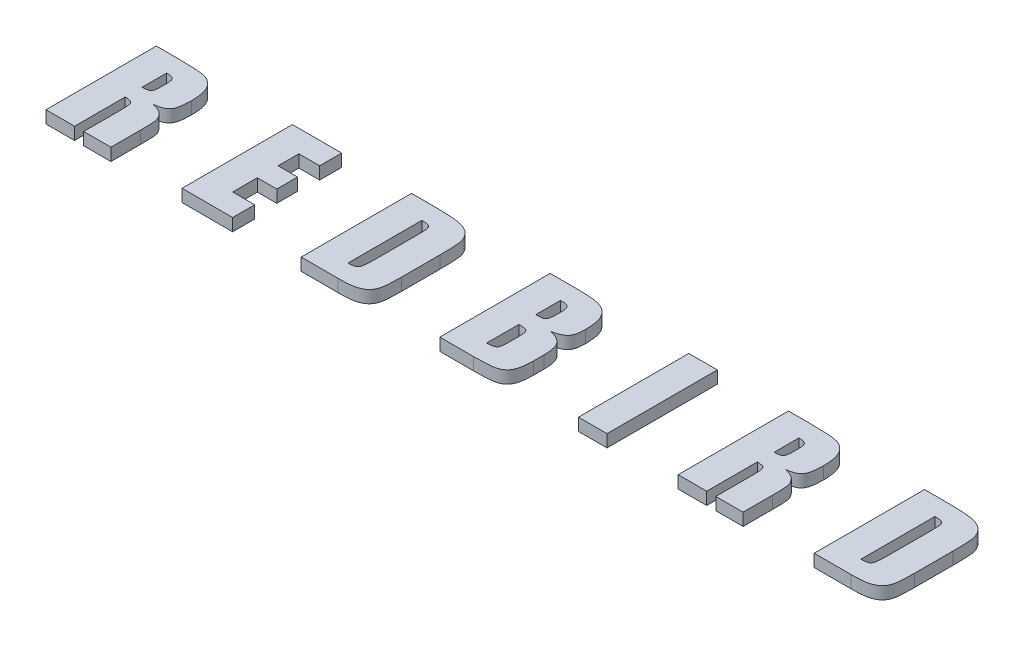
from build123d import *

# Parameters (mm, degrees)
BOSS_EXTRUDE1_DEPTH   = 2
BOSS_EXTRUDE1_2_DEPTH = 2
BOSS_EXTRUDE1_3_DEPTH = 2
BOSS_EXTRUDE1_4_DEPTH = 2
SKETCH1_W             = 4.607058824
SKETCH1_H             = 17.8
BOSS_EXTRUDE1_5_DEPTH = 2
BOSS_EXTRUDE1_6_DEPTH = 2
BOSS_EXTRUDE1_7_DEPTH = 2


with BuildPart() as part:
    # Sketch1 → Boss-Extrude1 (new body)
    with BuildSketch(Plane(origin=(0, 0, 0), x_dir=(1, 0, 0), z_dir=(0, 1, 0))):
        with BuildLine():
            Line((-82.469050164, 17.8), (-79.151182517, 17.8))
            add(Edge.make_bspline(
                [(-79.151182517, 17.8), (-78.885048071, 17.799746774), (-78.37564711, 17.79926208), (-77.645936562, 17.78538026), (-76.983846399, 17.766002963), (-76.388090793, 17.741565138), (-75.859027453, 17.705452776), (-75.397437707, 17.663742527), (-75.002990983, 17.616494116), (-74.665900726, 17.557852604), (-74.368796495, 17.481561226), (-74.09458711, 17.381352943), (-73.832210295, 17.262100109), (-73.584721874, 17.113096617), (-73.35386095, 16.938161971), (-73.131375941, 16.74588602), (-72.928888586, 16.522491955), (-72.73405574, 16.278492607), (-72.557936751, 16.000139591), (-72.408995424, 15.684134256), (-72.281156478, 15.331396038), (-72.177457893, 14.940358153), (-72.097142861, 14.51155242), (-72.037781889, 14.045112188), (-72.007210989, 13.540187643), (-72.001448573, 13.190795077), (-71.998461929, 13.009705882)],
                knots=[0, 0, 0, 0, 1.866779899, 3.573154429, 5.119271976, 6.513038993, 7.755301935, 8.838622109, 9.763847579, 10.541210176, 11.237085048, 11.91229758, 12.586642675, 13.255803272, 13.93365463, 14.616667368, 15.3150611, 16.045129356, 16.805014908, 17.619443337, 18.490747182, 19.433519973, 20.453845581, 21.548934602, 22.729619622, 24, 24, 24, 24], degree=3))
            add(Edge.make_bspline(
                [(-71.998461929, 13.009705882), (-71.998869517, 12.846042972), (-71.99964997, 12.532659944), (-72.028811716, 12.083224302), (-72.0634222, 11.675172901), (-72.124520729, 11.309740541), (-72.193829031, 10.985329626), (-72.280999434, 10.700488785), (-72.387608539, 10.458773482), (-72.511432704, 10.253578282), (-72.661484897, 10.080963205), (-72.839729815, 9.929217942), (-73.052023992, 9.799607152), (-73.29319038, 9.68449234), (-73.564983969, 9.586848051), (-73.868786276, 9.509887602), (-74.20301941, 9.446466222), (-74.438073064, 9.422777669), (-74.560483988, 9.410441176)],
                knots=[0, 0, 0, 0, 1.535739318, 2.940645737, 4.22619795, 5.377388088, 6.415609046, 7.338391501, 8.167869762, 8.889512328, 9.579072284, 10.305275152, 11.07790705, 11.906690103, 12.810190808, 13.783547141, 14.845718681, 16, 16, 16, 16], degree=3))
            add(Edge.make_bspline(
                [(-74.560483988, 9.410441176), (-74.450160573, 9.380493895), (-74.237295397, 9.322711661), (-73.932459733, 9.229695807), (-73.656494643, 9.125762822), (-73.411918643, 9.010299375), (-73.192401918, 8.893331362), (-73.002780633, 8.766179313), (-72.840047843, 8.631554403), (-72.666600073, 8.44707956), (-72.492335549, 8.214819331), (-72.31861125, 7.9434932), (-72.19303994, 7.681005162), (-72.119319313, 7.458291592), (-72.086834132, 7.256791003), (-72.059332836, 7.056358761), (-72.042721933, 6.801649037), (-72.025999062, 6.494091862), (-72.013809709, 6.134078726), (-72.002972558, 5.721803901), (-72.002088123, 5.256010182), (-71.999715329, 4.927717909), (-71.998461929, 4.754301471)],
                knots=[0, 0, 0, 0, 1.142598363, 2.204603636, 3.184543099, 4.08681795, 4.906404162, 5.66835307, 6.364867417, 7.012577891, 8.194392783, 9.262145755, 10.227668168, 11.096526183, 11.594793942, 12.265491166, 13.118334537, 14.144541448, 15.344519214, 16.718520618, 18.266598052, 20, 20, 20, 20], degree=3))
            Line((-71.998461929, 4.754301471), (-71.998461929, 0))
            Line((-71.998461929, 0), (-76.396108988, 0))
            Line((-76.396108988, 0), (-76.396108988, 6.020588235))
            add(Edge.make_bspline(
                [(-76.396108988, 6.020588235), (-76.396783572, 6.136201112), (-76.39806301, 6.355476342), (-76.406249688, 6.666596639), (-76.426883667, 6.943659859), (-76.451190776, 7.186237495), (-76.484322609, 7.394761595), (-76.520619455, 7.568797628), (-76.569786112, 7.708249074), (-76.626025661, 7.819041817), (-76.699298274, 7.908496927), (-76.798977456, 7.975284088), (-76.916242846, 8.038667249), (-77.06001769, 8.087120212), (-77.227208604, 8.121104974), (-77.417438538, 8.146910743), (-77.631585306, 8.163119692), (-77.782340661, 8.165697078), (-77.861991341, 8.167058824)],
                knots=[0, 0, 0, 0, 1.760695112, 3.339392938, 4.738153348, 5.990939473, 7.050443991, 7.953034352, 8.693792368, 9.295646617, 9.837944077, 10.432650982, 11.108765438, 11.865186032, 12.731754792, 13.704231872, 14.787044802, 16, 16, 16, 16], degree=3))
            Line((-77.861991341, 8.167058824), (-77.861991341, 0))
            Line((-77.861991341, 0), (-82.469050164, 0))
            Line((-82.469050164, 0), (-82.469050164, 17.8))
        make_face()
        with BuildLine():
            Line((-77.861991341, 14.868235294), (-77.861991341, 10.889411765))
            add(Edge.make_bspline(
                [(-77.861991341, 10.889411765), (-77.736431229, 10.891103762), (-77.504081576, 10.894234811), (-77.186775362, 10.936223191), (-76.929311716, 10.998988843), (-76.749299256, 11.076627881), (-76.64096283, 11.175825675), (-76.571312497, 11.276521012), (-76.518574108, 11.410155102), (-76.473134831, 11.571374015), (-76.43851351, 11.762055014), (-76.411913041, 11.981596165), (-76.401285797, 12.231954117), (-76.397903559, 12.40873769), (-76.396108988, 12.502536765)],
                knots=[0, 0, 0, 0, 1.706714887, 3.158284942, 4.338247242, 5.313333341, 5.775274278, 6.318418262, 6.963057242, 7.71890888, 8.594501264, 9.595306132, 10.724100569, 12, 12, 12, 12], degree=3))
            Line((-76.396108988, 12.502536765), (-76.396108988, 13.487426471))
            add(Edge.make_bspline(
                [(-76.396108988, 13.487426471), (-76.399040934, 13.617487449), (-76.404376312, 13.854164558), (-76.460776381, 14.174342074), (-76.554858584, 14.425980847), (-76.701226961, 14.615602183), (-76.911993474, 14.731507463), (-77.171143004, 14.815452592), (-77.496251155, 14.860484524), (-77.733183614, 14.865505599), (-77.861991341, 14.868235294)],
                knots=[0, 0, 0, 0, 1.304469539, 2.37379483, 3.247992823, 3.979792534, 4.721435155, 5.621572954, 6.706974207, 8, 8, 8, 8], degree=3))
        make_face(mode=Mode.SUBTRACT)
    extrude(amount=BOSS_EXTRUDE1_DEPTH)


with BuildPart() as body_2:
    # Sketch1 → Boss-Extrude1 2 (new body)
    with BuildSketch(Plane(origin=(0, 0, 0), x_dir=(1, 0, 0), z_dir=(0, 1, 0))):
        Polygon((-60.522697223, 17.8), (-52.565050164, 17.8), (-52.565050164, 14.24), (-55.915638399, 14.24), (-55.915638399, 10.889411765), (-52.774461929, 10.889411765), (-52.774461929, 7.538823529), (-55.915638399, 7.538823529), (-55.915638399, 3.56), (-52.355638399, 3.56), (-52.355638399, 0), (-60.522697223, 0), align=None)
    extrude(amount=BOSS_EXTRUDE1_2_DEPTH)


with BuildPart() as body_3:
    # Sketch1 → Boss-Extrude1 3 (new body)
    with BuildSketch(Plane(origin=(0, 0, 0), x_dir=(1, 0, 0), z_dir=(0, 1, 0))):
        with BuildLine():
            Line((-41.298697223, 17.8), (-37.781233988, 17.8))
            add(Edge.make_bspline(
                [(-37.781233988, 17.8), (-37.508549339, 17.800102765), (-36.987118488, 17.800299273), (-36.238893338, 17.781790192), (-35.559266919, 17.760347417), (-34.948061583, 17.729955743), (-34.407151589, 17.682762032), (-33.934349003, 17.632224875), (-33.529879848, 17.572429063), (-33.090804099, 17.478858112), (-32.620956789, 17.329011045), (-32.121340123, 17.104040025), (-31.69315818, 16.826517371), (-31.343233635, 16.492717791), (-31.059556187, 16.12966347), (-30.832828497, 15.744395814), (-30.664420262, 15.33950577), (-30.5718119, 14.977630999), (-30.527083061, 14.655007758), (-30.493682387, 14.360541214), (-30.469945181, 14.014388557), (-30.445584701, 13.616371964), (-30.431502301, 13.166812212), (-30.416996352, 12.664043156), (-30.412028362, 12.109896952), (-30.410225141, 11.722695093), (-30.409285458, 11.520919118)],
                knots=[0, 0, 0, 0, 1.647732484, 3.150813787, 4.522492356, 5.756747403, 6.848149703, 7.803076608, 8.6298837, 9.317612603, 10.514070139, 11.602283645, 12.620483519, 13.580944175, 14.510468184, 15.396689994, 16.274291962, 17.15189393, 17.644977889, 18.241807204, 18.942427062, 19.741256606, 20.651394465, 21.66014324, 22.780669903, 24, 24, 24, 24], degree=3))
            Line((-30.409285458, 11.520919118), (-30.409285458, 5.287647059))
            add(Edge.make_bspline(
                [(-30.409285458, 5.287647059), (-30.410008402, 5.09677847), (-30.411396557, 4.730283164), (-30.419208468, 4.205482947), (-30.441269173, 3.730071581), (-30.460931467, 3.304277182), (-30.494507294, 2.929053845), (-30.531588676, 2.60221616), (-30.580758608, 2.326242954), (-30.64793831, 2.02697032), (-30.7597953, 1.704407019), (-30.942337654, 1.36405146), (-31.162901496, 1.062933513), (-31.431165683, 0.810322495), (-31.737229902, 0.600632485), (-32.074139183, 0.422368125), (-32.445247736, 0.2786765), (-32.781047606, 0.190090867), (-33.073999282, 0.134014704), (-33.324311921, 0.099636441), (-33.599983377, 0.065289151), (-33.903725382, 0.044746326), (-34.232020587, 0.025329432), (-34.587515855, 0.006989652), (-34.969440586, 0.002998232), (-35.233394383, 0.001021159), (-35.369726635, 0)],
                knots=[0, 0, 0, 0, 1.555791815, 2.987345376, 4.277512103, 5.434898526, 6.461117292, 7.347678525, 8.115012592, 8.744704908, 9.846861435, 10.884910755, 11.882385618, 12.875930665, 13.872255975, 14.898282186, 15.976332072, 17.108484732, 17.723959223, 18.406646654, 19.167516123, 19.987768807, 20.887251258, 21.848409784, 22.888702715, 24, 24, 24, 24], degree=3))
            Line((-35.369726635, 0), (-41.298697223, 0))
            Line((-41.298697223, 0), (-41.298697223, 17.8))
        make_face()
        with BuildLine():
            Line((-36.691638399, 14.868235294), (-36.691638399, 2.931764706))
            add(Edge.make_bspline(
                [(-36.691638399, 2.931764706), (-36.601084462, 2.932934173), (-36.428467074, 2.935163456), (-36.182383624, 2.954099608), (-35.964194138, 2.987488448), (-35.771737032, 3.02604445), (-35.609967674, 3.088190316), (-35.469550131, 3.15301294), (-35.360254371, 3.23937606), (-35.273711745, 3.342126343), (-35.21107877, 3.475039749), (-35.160746002, 3.645130255), (-35.116203298, 3.858685916), (-35.077816097, 4.115353039), (-35.048822893, 4.415690404), (-35.031123613, 4.759588297), (-35.016941394, 5.147923413), (-35.016550041, 5.421785541), (-35.016344282, 5.565772059)],
                knots=[0, 0, 0, 0, 1.15083661, 2.193768883, 3.132775297, 3.956688284, 4.680278661, 5.331177994, 5.91352505, 6.435313492, 7.024222413, 7.765131037, 8.686789015, 9.794406953, 11.061955528, 12.519784999, 14.170232443, 16, 16, 16, 16], degree=3))
            Line((-35.016344282, 5.565772059), (-35.016344282, 12.617058824))
            add(Edge.make_bspline(
                [(-35.016344282, 12.617058824), (-35.01565768, 12.715228837), (-35.014352948, 12.901778791), (-35.023105181, 13.167857897), (-35.028374013, 13.406776059), (-35.037406103, 13.61850345), (-35.052117089, 13.801521517), (-35.061950901, 13.957105844), (-35.083637447, 14.084252606), (-35.106270567, 14.217962971), (-35.157821815, 14.356986961), (-35.242305594, 14.502315777), (-35.361883573, 14.619475724), (-35.514627316, 14.716308888), (-35.717442516, 14.787409643), (-35.981552385, 14.837702327), (-36.31376533, 14.863334291), (-36.558540458, 14.866509018), (-36.691638399, 14.868235294)],
                knots=[0, 0, 0, 0, 1.362971426, 2.590019582, 3.69595568, 4.681371814, 5.531603618, 6.245950658, 6.84352033, 7.321700785, 8.126479698, 8.887462659, 9.6370587, 10.426879731, 11.380478843, 12.6011556, 14.151858001, 16, 16, 16, 16], degree=3))
        make_face(mode=Mode.SUBTRACT)
    extrude(amount=BOSS_EXTRUDE1_3_DEPTH)


with BuildPart() as body_4:
    # Sketch1 → Boss-Extrude1 4 (new body)
    with BuildSketch(Plane(origin=(0, 0, 0), x_dir=(1, 0, 0), z_dir=(0, 1, 0))):
        with BuildLine():
            Line((-18.933520752, 17.8), (-14.21193987, 17.8))
            add(Edge.make_bspline(
                [(-14.21193987, 17.8), (-14.030881322, 17.798215606), (-13.680718069, 17.794764628), (-13.172247627, 17.783283525), (-12.697460315, 17.757998825), (-12.257020599, 17.716947685), (-11.849385599, 17.673942707), (-11.476264064, 17.61426461), (-11.13650243, 17.546658875), (-10.826490282, 17.468462081), (-10.541084714, 17.372032363), (-10.271670981, 17.258730051), (-10.017881677, 17.119815932), (-9.77912315, 16.958572179), (-9.551549918, 16.778106515), (-9.339376157, 16.575240152), (-9.141748138, 16.35047919), (-8.956672505, 16.103659765), (-8.786753706, 15.826445443), (-8.643630197, 15.509534551), (-8.524377887, 15.153766247), (-8.421621611, 14.760688526), (-8.349869241, 14.327773932), (-8.294500362, 13.857203524), (-8.256852374, 13.347330805), (-8.254657542, 12.993416419), (-8.253520752, 12.810110294)],
                knots=[0, 0, 0, 0, 1.41969272, 2.745654521, 3.987543411, 5.14658096, 6.21373459, 7.200711201, 8.108042895, 8.929411192, 9.70554979, 10.467999137, 11.218070552, 11.969943563, 12.724535131, 13.49271798, 14.268243868, 15.068689038, 15.909069341, 16.81215954, 17.78844528, 18.848344307, 19.994182421, 21.225693104, 22.563077773, 24, 24, 24, 24], degree=3))
            add(Edge.make_bspline(
                [(-8.253520752, 12.810110294), (-8.254039804, 12.686801502), (-8.255037904, 12.449687527), (-8.28304065, 12.109078176), (-8.321637275, 11.797841424), (-8.371673669, 11.513624369), (-8.443763709, 11.260069262), (-8.52865983, 11.033693464), (-8.629172716, 10.8360276), (-8.749896402, 10.663661712), (-8.895509258, 10.512841684), (-9.068913512, 10.374732133), (-9.270276075, 10.244638587), (-9.504612436, 10.127906655), (-9.764768571, 10.011047585), (-10.060138905, 9.914190252), (-10.382099904, 9.816202068), (-10.609013965, 9.764549287), (-10.727197223, 9.737647059)],
                knots=[0, 0, 0, 0, 1.327920484, 2.553495959, 3.678584238, 4.706394844, 5.65862556, 6.514014339, 7.30753027, 8.04101456, 8.772331145, 9.55771541, 10.424646689, 11.349518022, 12.375513716, 13.493956262, 14.694781581, 16, 16, 16, 16], degree=3))
            add(Edge.make_bspline(
                [(-10.727197223, 9.737647059), (-10.601279599, 9.706684861), (-10.358099154, 9.646888617), (-10.012678873, 9.531408307), (-9.698935289, 9.401088126), (-9.415037598, 9.258141364), (-9.164060714, 9.096657071), (-8.944447917, 8.92033558), (-8.754414603, 8.729803472), (-8.598832808, 8.518717666), (-8.465844764, 8.287916726), (-8.350909937, 8.03169773), (-8.25809336, 7.74584821), (-8.179019316, 7.432195505), (-8.11775844, 7.091114732), (-8.076268019, 6.720549112), (-8.050023343, 6.323085458), (-8.046120518, 6.047898533), (-8.044108988, 5.906066176)],
                knots=[0, 0, 0, 0, 1.193541528, 2.305046348, 3.349469872, 4.319601517, 5.227715379, 6.091898615, 6.908561027, 7.697906746, 8.498857849, 9.357421084, 10.27838222, 11.262396817, 12.333987418, 13.466302598, 14.694123014, 16, 16, 16, 16], degree=3))
            Line((-8.044108988, 5.906066176), (-8.044108988, 4.234044118))
            add(Edge.make_bspline(
                [(-8.044108988, 4.234044118), (-8.045276464, 4.086778121), (-8.0475347, 3.801923209), (-8.067305784, 3.389366425), (-8.099333835, 3.006174147), (-8.144593977, 2.652322203), (-8.202837966, 2.327757819), (-8.274219142, 2.032489133), (-8.358510821, 1.766277757), (-8.486871314, 1.45675461), (-8.684462209, 1.11524493), (-8.993296288, 0.773692342), (-9.362684022, 0.500390234), (-9.725871907, 0.333975205), (-10.065742934, 0.237687238), (-10.38404695, 0.173061224), (-10.760915292, 0.118666551), (-11.199042201, 0.078736248), (-11.694226767, 0.042464883), (-12.250627393, 0.015961978), (-12.865993084, 0.005317891), (-13.296852894, 0.00182267), (-13.521535458, 0)],
                knots=[0, 0, 0, 0, 1.057231904, 2.044991421, 2.964498811, 3.817267374, 4.605195048, 5.330688826, 5.996832831, 6.607610909, 7.734358025, 8.809960447, 9.890596186, 11.011751471, 11.656044114, 12.423911222, 13.341950389, 14.388368498, 15.581715371, 16.906549738, 18.386843414, 20, 20, 20, 20], degree=3))
            Line((-13.521535458, 0), (-18.933520752, 0))
            Line((-18.933520752, 0), (-18.933520752, 17.8))
        make_face()
        with BuildLine():
            Line((-14.326461929, 14.868235294), (-14.326461929, 10.889411765))
            add(Edge.make_bspline(
                [(-14.326461929, 10.889411765), (-14.229394757, 10.891802056), (-14.059264852, 10.895991527), (-13.889098946, 10.89825562), (-13.816020752, 10.899227941)],
                knots=[0, 0, 0, 0, 1.141094767, 2, 2, 2, 2], degree=3))
            add(Edge.make_bspline(
                [(-13.816020752, 10.899227941), (-13.701028982, 10.901293256), (-13.49268953, 10.905035145), (-13.21343169, 10.970625945), (-12.995585365, 11.071754432), (-12.864506151, 11.207400884), (-12.80140399, 11.350836532), (-12.760103303, 11.49489817), (-12.729944127, 11.678481174), (-12.70004349, 11.899841282), (-12.678333105, 12.161953036), (-12.66248943, 12.462013936), (-12.652743935, 12.801322181), (-12.651713508, 13.040238465), (-12.651167811, 13.166764706)],
                knots=[0, 0, 0, 0, 1.37184632, 2.485479705, 3.407178563, 4.210095408, 4.671083265, 5.269542147, 5.998719677, 6.893441603, 7.940942625, 9.142754617, 10.486848569, 12, 12, 12, 12], degree=3))
            add(Edge.make_bspline(
                [(-12.651167811, 13.166764706), (-12.65231591, 13.296666005), (-12.654433301, 13.53623766), (-12.687064177, 13.863304684), (-12.73432505, 14.129642605), (-12.811042301, 14.336937195), (-12.9052351, 14.496253264), (-13.011580288, 14.620424871), (-13.130414812, 14.7157775), (-13.273715503, 14.77811673), (-13.453442662, 14.815801596), (-13.686607089, 14.843152077), (-13.984816282, 14.86168643), (-14.205366814, 14.865914072), (-14.326461929, 14.868235294)],
                knots=[0, 0, 0, 0, 1.612962093, 2.974720053, 4.080187332, 4.963539136, 5.704836737, 6.3676796, 6.985654596, 7.580003915, 8.289925548, 9.259673838, 10.495400982, 12, 12, 12, 12], degree=3))
        make_face(mode=Mode.SUBTRACT)
        with BuildLine():
            Line((-14.326461929, 8.167058824), (-14.326461929, 2.931764706))
            add(Edge.make_bspline(
                [(-14.326461929, 2.931764706), (-14.240275252, 2.935617731), (-14.076453024, 2.942941497), (-13.842559993, 2.961313051), (-13.634180053, 2.991261252), (-13.448848097, 3.025601994), (-13.288277448, 3.071804508), (-13.150766794, 3.122878503), (-13.036543358, 3.18055035), (-12.945819886, 3.252703591), (-12.87434346, 3.344144479), (-12.811489118, 3.455893073), (-12.764695756, 3.597441327), (-12.72255276, 3.76240239), (-12.690219981, 3.953953528), (-12.669137799, 4.171531691), (-12.650913368, 4.414804501), (-12.651080571, 4.586295308), (-12.651167811, 4.675772059)],
                knots=[0, 0, 0, 0, 1.419095288, 2.697393149, 3.856866357, 4.880718774, 5.794967692, 6.601281627, 7.291456808, 7.891047755, 8.490638702, 9.189387817, 9.989490768, 10.933700266, 11.989587216, 13.180284702, 14.528790147, 16, 16, 16, 16], degree=3))
            Line((-12.651167811, 4.675772059), (-12.651167811, 6.423051471))
            add(Edge.make_bspline(
                [(-12.651167811, 6.423051471), (-12.651564868, 6.517943095), (-12.652318352, 6.698016136), (-12.66402964, 6.953699911), (-12.689933764, 7.180083891), (-12.710189015, 7.378283425), (-12.75250868, 7.544716353), (-12.79518603, 7.683530882), (-12.850706098, 7.792845807), (-12.915359194, 7.879179809), (-13.003489129, 7.941026231), (-13.110815703, 7.996280919), (-13.24816444, 8.040619787), (-13.411299509, 8.078921378), (-13.601532708, 8.111010676), (-13.818829852, 8.136797559), (-14.063348246, 8.156087781), (-14.235903278, 8.163282802), (-14.326461929, 8.167058824)],
                knots=[0, 0, 0, 0, 1.538310229, 2.919206019, 4.145426389, 5.233175983, 6.142307499, 6.925059207, 7.5813867, 8.122596664, 8.653013429, 9.309340922, 10.075339784, 10.9844713, 12.025073956, 13.200531974, 14.530810454, 16, 16, 16, 16], degree=3))
        make_face(mode=Mode.SUBTRACT)
    extrude(amount=BOSS_EXTRUDE1_4_DEPTH)


with BuildPart() as body_5:
    # Sketch1 → Boss-Extrude1 5 (new body)
    with BuildSketch(Plane(origin=(0, 0, 0), x_dir=(1, 0, 0), z_dir=(0, 1, 0))):
        with Locations((5.73518513, 8.9)):
            Rectangle(SKETCH1_W, SKETCH1_H)
    extrude(amount=BOSS_EXTRUDE1_5_DEPTH)


with BuildPart() as body_6:
    # Sketch1 → Boss-Extrude1 6 (new body)
    with BuildSketch(Plane(origin=(0, 0, 0), x_dir=(1, 0, 0), z_dir=(0, 1, 0))):
        with BuildLine():
            Line((19.514479248, 17.8), (22.832346895, 17.8))
            add(Edge.make_bspline(
                [(22.832346895, 17.8), (23.098481341, 17.799746774), (23.607882302, 17.79926208), (24.337592849, 17.78538026), (24.999683013, 17.766002963), (25.595438619, 17.741565138), (26.124501959, 17.705452776), (26.586091705, 17.663742527), (26.980538428, 17.616494116), (27.317628686, 17.557852604), (27.614732917, 17.481561226), (27.888942301, 17.381352943), (28.151319116, 17.262100109), (28.398807538, 17.113096617), (28.629668462, 16.938161971), (28.852153471, 16.74588602), (29.054640826, 16.522491955), (29.249473672, 16.278492607), (29.42559266, 16.000139591), (29.574533988, 15.684134256), (29.702372934, 15.331396038), (29.806071519, 14.940358153), (29.88638655, 14.51155242), (29.945747523, 14.045112188), (29.976318423, 13.540187643), (29.982080839, 13.190795077), (29.985067483, 13.009705882)],
                knots=[0, 0, 0, 0, 1.866779899, 3.573154429, 5.119271976, 6.513038993, 7.755301935, 8.838622109, 9.763847579, 10.541210176, 11.237085048, 11.91229758, 12.586642675, 13.255803272, 13.93365463, 14.616667368, 15.3150611, 16.045129356, 16.805014908, 17.619443337, 18.490747182, 19.433519973, 20.453845581, 21.548934602, 22.729619622, 24, 24, 24, 24], degree=3))
            add(Edge.make_bspline(
                [(29.985067483, 13.009705882), (29.984659895, 12.846042972), (29.983879442, 12.532659944), (29.954717696, 12.083224302), (29.920107211, 11.675172901), (29.859008683, 11.309740541), (29.789700381, 10.985329626), (29.702529978, 10.700488785), (29.595920873, 10.458773482), (29.472096708, 10.253578282), (29.322044515, 10.080963205), (29.143799597, 9.929217942), (28.931505419, 9.799607152), (28.690339031, 9.68449234), (28.418545443, 9.586848051), (28.114743136, 9.509887602), (27.780510001, 9.446466222), (27.545456348, 9.422777669), (27.423045424, 9.410441176)],
                knots=[0, 0, 0, 0, 1.535739318, 2.940645737, 4.22619795, 5.377388088, 6.415609046, 7.338391501, 8.167869762, 8.889512328, 9.579072284, 10.305275152, 11.07790705, 11.906690103, 12.810190808, 13.783547141, 14.845718681, 16, 16, 16, 16], degree=3))
            add(Edge.make_bspline(
                [(27.423045424, 9.410441176), (27.533368839, 9.380493895), (27.746234014, 9.322711661), (28.051069678, 9.229695807), (28.327034768, 9.125762822), (28.571610769, 9.010299375), (28.791127493, 8.893331362), (28.980748778, 8.766179313), (29.143481569, 8.631554403), (29.316929339, 8.44707956), (29.491193863, 8.214819331), (29.664918162, 7.9434932), (29.790489472, 7.681005162), (29.864210099, 7.458291592), (29.89669528, 7.256791003), (29.924196576, 7.056358761), (29.940807478, 6.801649037), (29.95753035, 6.494091862), (29.969719702, 6.134078726), (29.980556854, 5.721803901), (29.981441289, 5.256010182), (29.983814083, 4.927717909), (29.985067483, 4.754301471)],
                knots=[0, 0, 0, 0, 1.142598363, 2.204603636, 3.184543099, 4.08681795, 4.906404162, 5.66835307, 6.364867417, 7.012577891, 8.194392783, 9.262145755, 10.227668168, 11.096526183, 11.594793942, 12.265491166, 13.118334537, 14.144541448, 15.344519214, 16.718520618, 18.266598052, 20, 20, 20, 20], degree=3))
            Line((29.985067483, 4.754301471), (29.985067483, 0))
            Line((29.985067483, 0), (25.587420424, 0))
            Line((25.587420424, 0), (25.587420424, 6.020588235))
            add(Edge.make_bspline(
                [(25.587420424, 6.020588235), (25.58674584, 6.136201112), (25.585466402, 6.355476342), (25.577279723, 6.666596639), (25.556645745, 6.943659859), (25.532338636, 7.186237495), (25.499206803, 7.394761595), (25.462909956, 7.568797628), (25.413743299, 7.708249074), (25.357503751, 7.819041817), (25.284231137, 7.908496927), (25.184551956, 7.975284088), (25.067286566, 8.038667249), (24.923511722, 8.087120212), (24.756320808, 8.121104974), (24.566090873, 8.146910743), (24.351944106, 8.163119692), (24.201188751, 8.165697078), (24.121538071, 8.167058824)],
                knots=[0, 0, 0, 0, 1.760695112, 3.339392938, 4.738153348, 5.990939473, 7.050443991, 7.953034352, 8.693792368, 9.295646617, 9.837944077, 10.432650982, 11.108765438, 11.865186032, 12.731754792, 13.704231872, 14.787044802, 16, 16, 16, 16], degree=3))
            Line((24.121538071, 8.167058824), (24.121538071, 0))
            Line((24.121538071, 0), (19.514479248, 0))
            Line((19.514479248, 0), (19.514479248, 17.8))
        make_face()
        with BuildLine():
            Line((24.121538071, 14.868235294), (24.121538071, 10.889411765))
            add(Edge.make_bspline(
                [(24.121538071, 10.889411765), (24.247098183, 10.891103762), (24.479447836, 10.894234811), (24.79675405, 10.936223191), (25.054217695, 10.998988843), (25.234230156, 11.076627881), (25.342566581, 11.175825675), (25.412216915, 11.276521012), (25.464955304, 11.410155102), (25.510394581, 11.571374015), (25.545015902, 11.762055014), (25.571616371, 11.981596165), (25.582243615, 12.231954117), (25.585625852, 12.40873769), (25.587420424, 12.502536765)],
                knots=[0, 0, 0, 0, 1.706714887, 3.158284942, 4.338247242, 5.313333341, 5.775274278, 6.318418262, 6.963057242, 7.71890888, 8.594501264, 9.595306132, 10.724100569, 12, 12, 12, 12], degree=3))
            Line((25.587420424, 12.502536765), (25.587420424, 13.487426471))
            add(Edge.make_bspline(
                [(25.587420424, 13.487426471), (25.584488478, 13.617487449), (25.5791531, 13.854164558), (25.522753031, 14.174342074), (25.428670828, 14.425980847), (25.28230245, 14.615602183), (25.071535938, 14.731507463), (24.812386408, 14.815452592), (24.487278257, 14.860484524), (24.250345798, 14.865505599), (24.121538071, 14.868235294)],
                knots=[0, 0, 0, 0, 1.304469539, 2.37379483, 3.247992823, 3.979792534, 4.721435155, 5.621572954, 6.706974207, 8, 8, 8, 8], degree=3))
        make_face(mode=Mode.SUBTRACT)
    extrude(amount=BOSS_EXTRUDE1_6_DEPTH)


with BuildPart() as body_7:
    # Sketch1 → Boss-Extrude1 7 (new body)
    with BuildSketch(Plane(origin=(0, 0, 0), x_dir=(1, 0, 0), z_dir=(0, 1, 0))):
        with BuildLine():
            Line((41.460832189, 17.8), (44.978295424, 17.8))
            add(Edge.make_bspline(
                [(44.978295424, 17.8), (45.250980073, 17.800102765), (45.772410924, 17.800299273), (46.520636074, 17.781790192), (47.200262492, 17.760347417), (47.811467829, 17.729955743), (48.352377823, 17.682762032), (48.825180409, 17.632224875), (49.229649564, 17.572429063), (49.668725313, 17.478858112), (50.138572623, 17.329011045), (50.638189289, 17.104040025), (51.066371232, 16.826517371), (51.416295777, 16.492717791), (51.699973225, 16.12966347), (51.926700915, 15.744395814), (52.09510915, 15.33950577), (52.187717512, 14.977630999), (52.232446351, 14.655007758), (52.265847025, 14.360541214), (52.289584231, 14.014388557), (52.313944711, 13.616371964), (52.328027111, 13.166812212), (52.34253306, 12.664043156), (52.347501049, 12.109896952), (52.349304271, 11.722695093), (52.350243953, 11.520919118)],
                knots=[0, 0, 0, 0, 1.647732484, 3.150813787, 4.522492356, 5.756747403, 6.848149703, 7.803076608, 8.6298837, 9.317612603, 10.514070139, 11.602283645, 12.620483519, 13.580944175, 14.510468184, 15.396689994, 16.274291962, 17.15189393, 17.644977889, 18.241807204, 18.942427062, 19.741256606, 20.651394465, 21.66014324, 22.780669903, 24, 24, 24, 24], degree=3))
            Line((52.350243953, 11.520919118), (52.350243953, 5.287647059))
            add(Edge.make_bspline(
                [(52.350243953, 5.287647059), (52.34952101, 5.09677847), (52.348132855, 4.730283164), (52.340320944, 4.205482947), (52.318260239, 3.730071581), (52.298597944, 3.304277182), (52.265022117, 2.929053845), (52.227940736, 2.60221616), (52.178770804, 2.326242954), (52.111591102, 2.02697032), (51.999734112, 1.704407019), (51.817191758, 1.36405146), (51.596627916, 1.062933513), (51.328363728, 0.810322495), (51.02229951, 0.600632485), (50.685390228, 0.422368125), (50.314281675, 0.2786765), (49.978481806, 0.190090867), (49.68553013, 0.134014704), (49.435217491, 0.099636441), (49.159546034, 0.065289151), (48.85580403, 0.044746326), (48.527508825, 0.025329432), (48.172013556, 0.006989652), (47.790088826, 0.002998232), (47.526135029, 0.001021159), (47.389802777, 0)],
                knots=[0, 0, 0, 0, 1.555791815, 2.987345376, 4.277512103, 5.434898526, 6.461117292, 7.347678525, 8.115012592, 8.744704908, 9.846861435, 10.884910755, 11.882385618, 12.875930665, 13.872255975, 14.898282186, 15.976332072, 17.108484732, 17.723959223, 18.406646654, 19.167516123, 19.987768807, 20.887251258, 21.848409784, 22.888702715, 24, 24, 24, 24], degree=3))
            Line((47.389802777, 0), (41.460832189, 0))
            Line((41.460832189, 0), (41.460832189, 17.8))
        make_face()
        with BuildLine():
            Line((46.067891012, 14.868235294), (46.067891012, 2.931764706))
            add(Edge.make_bspline(
                [(46.067891012, 2.931764706), (46.158444949, 2.932934173), (46.331062338, 2.935163456), (46.577145787, 2.954099608), (46.795335274, 2.987488448), (46.98779238, 3.02604445), (47.149561738, 3.088190316), (47.289979281, 3.15301294), (47.399275041, 3.23937606), (47.485817667, 3.342126343), (47.548450642, 3.475039749), (47.598783409, 3.645130255), (47.643326113, 3.858685916), (47.681713314, 4.115353039), (47.710706519, 4.415690404), (47.728405799, 4.759588297), (47.742588018, 5.147923413), (47.742979371, 5.421785541), (47.74318513, 5.565772059)],
                knots=[0, 0, 0, 0, 1.15083661, 2.193768883, 3.132775297, 3.956688284, 4.680278661, 5.331177994, 5.91352505, 6.435313492, 7.024222413, 7.765131037, 8.686789015, 9.794406953, 11.061955528, 12.519784999, 14.170232443, 16, 16, 16, 16], degree=3))
            Line((47.74318513, 5.565772059), (47.74318513, 12.617058824))
            add(Edge.make_bspline(
                [(47.74318513, 12.617058824), (47.743871732, 12.715228837), (47.745176464, 12.901778791), (47.736424231, 13.167857897), (47.731155399, 13.406776059), (47.722123308, 13.61850345), (47.707412323, 13.801521517), (47.697578511, 13.957105844), (47.675891965, 14.084252606), (47.653258845, 14.217962971), (47.601707597, 14.356986961), (47.517223818, 14.502315777), (47.397645839, 14.619475724), (47.244902095, 14.716308888), (47.042086896, 14.787409643), (46.777977026, 14.837702327), (46.445764082, 14.863334291), (46.200988954, 14.866509018), (46.067891012, 14.868235294)],
                knots=[0, 0, 0, 0, 1.362971426, 2.590019582, 3.69595568, 4.681371814, 5.531603618, 6.245950658, 6.84352033, 7.321700785, 8.126479698, 8.887462659, 9.6370587, 10.426879731, 11.380478843, 12.6011556, 14.151858001, 16, 16, 16, 16], degree=3))
        make_face(mode=Mode.SUBTRACT)
    extrude(amount=BOSS_EXTRUDE1_7_DEPTH)


solid = Compound([part.part, body_2.part, body_3.part, body_4.part, body_5.part, body_6.part, body_7.part])
